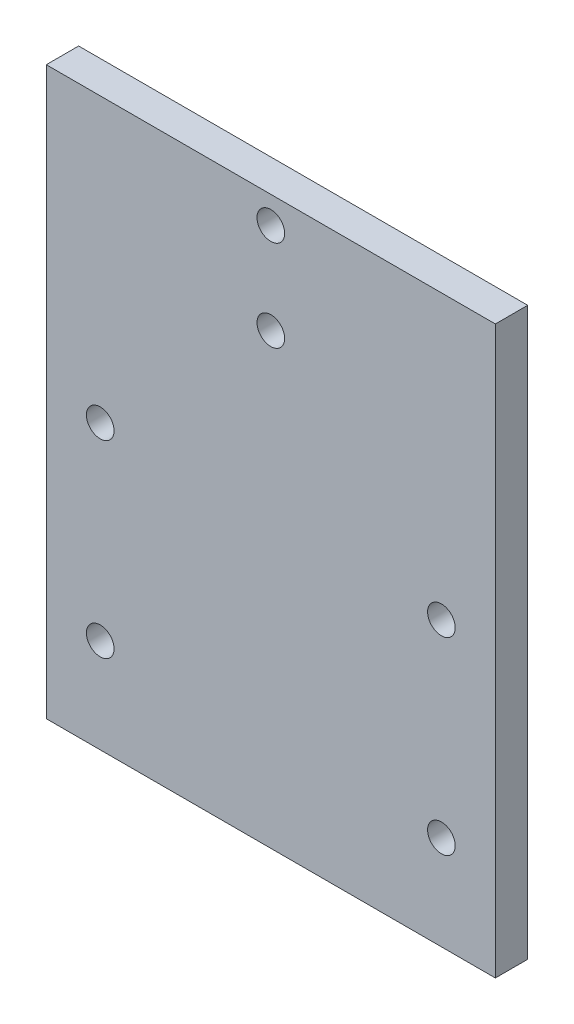
from build123d import *

# Parameters (mm, degrees)
SKETCH1_W                     = 33.3
SKETCH1_H                     = 42
BOSS_EXTRUDE1_DEPTH           = 2.4
M2_5_TAPPED_HOLE1_D           = 2.05
M2_5_TAPPED_HOLE1_CSINK_D     = 2.55
M2_5_TAPPED_HOLE1_CSINK_ANGLE = 90


with BuildPart() as part:
    # Sketch1 → Boss-Extrude1 (new body)
    with BuildSketch(Plane.XY):
        with Locations((0, -7)):
            Rectangle(SKETCH1_W, SKETCH1_H)
    extrude(amount=BOSS_EXTRUDE1_DEPTH)

    # M2.5 Tapped Hole1 (through all)
    with Locations(Plane(origin=(0, 12, 0), x_dir=(-1, 0, 0), z_dir=(0, 0, -1))):
        with Locations((0, 0), (0, -6.75), (12.65, -19), (12.65, -33), (-12.65, -33), (-12.65, -19)):
            CounterSinkHole(M2_5_TAPPED_HOLE1_D / 2, M2_5_TAPPED_HOLE1_CSINK_D / 2, counter_sink_angle=M2_5_TAPPED_HOLE1_CSINK_ANGLE)


solid = part.part
